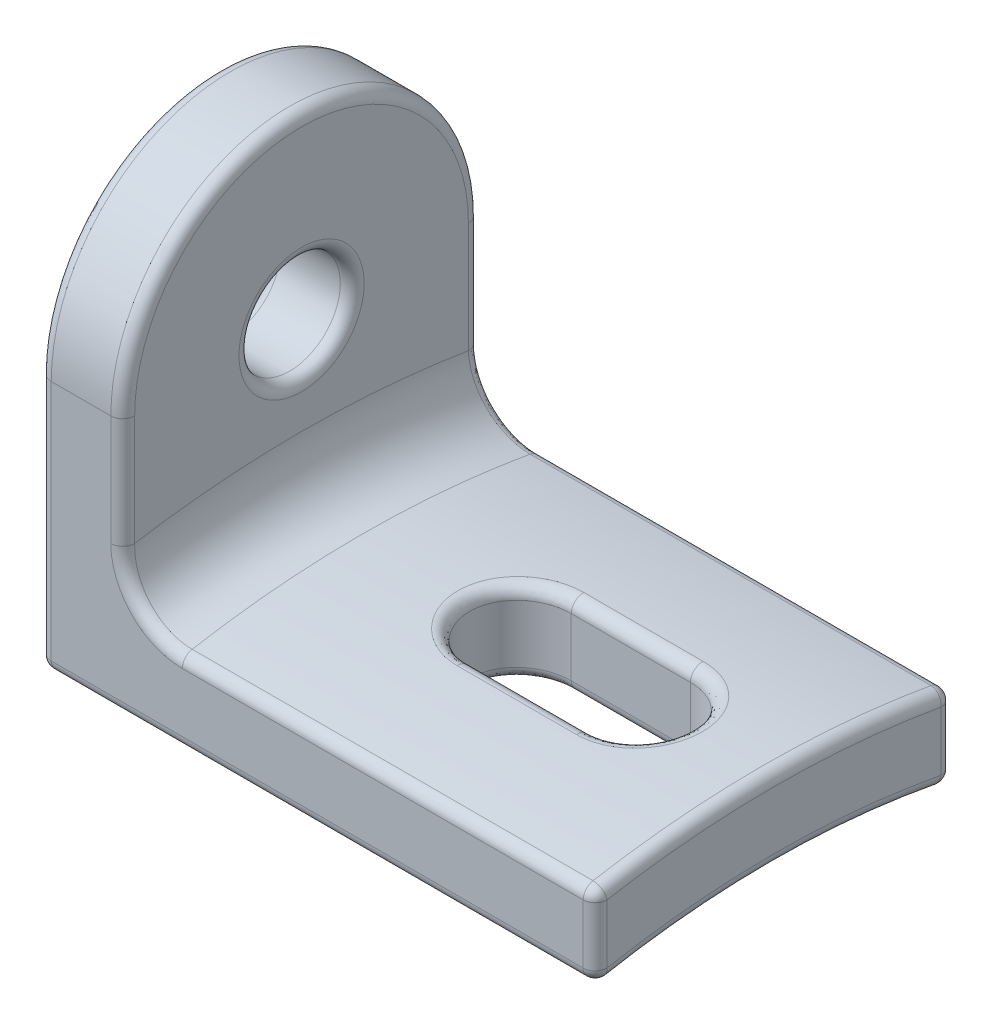
from build123d import *

# Parameters (mm, degrees)
SKETCH1_R           = 6
SKETCH1_R_2         = 1.7
BOSS_EXTRUDE1_DEPTH = 2.8
BOSS_EXTRUDE2_DEPTH = 18.65
CUT_EXTRUDE1_DEPTH  = 15.5
FILLET1_R           = 2
FILLET2_R           = 0.4


with BuildPart() as part:
    # Sketch1 → Boss-Extrude1 (new body)
    # profile 1 of 2: a face of its own
    with BuildSketch(Plane(origin=(0, 0, 0), x_dir=(0, 0, -1), z_dir=(1, 0, 0))):
        Circle(SKETCH1_R)
        Circle(SKETCH1_R_2, mode=Mode.SUBTRACT)
    # profile 2 of 2: a face of its own
    with BuildSketch(Plane(origin=(0, 0, 0), x_dir=(0, 0, -1), z_dir=(1, 0, 0))):
        with BuildLine():
            ThreePointArc((6, 0), (0, -6), (-6, 0))
            Line((-6, 0), (-6, -8.606123087))
            ThreePointArc((-6, -8.606123087), (0, -8), (6, -8.606123087))
            Line((6, -8.606123087), (6, 0))
        make_face()
    extrude(amount=BOSS_EXTRUDE1_DEPTH)

    # Sketch2 → Boss-Extrude2 (add)
    with BuildSketch(Plane.ZY):
        with BuildLine():
            Line((-6, -8.606123087), (-6, -5.806123087))
            ThreePointArc((-6, -5.806123087), (0, -5.251783091), (6, -5.806123087))
            Line((6, -5.806123087), (6, -8.606123087))
            ThreePointArc((6, -8.606123087), (0, -8), (-6, -8.606123087))
        make_face()
    extrude(amount=-BOSS_EXTRUDE2_DEPTH)

    # Sketch3 → Cut-Extrude1 (cut)
    with BuildSketch(Plane(origin=(0, 0, 0), x_dir=(1, 0, 0), z_dir=(0, 1, 0))):
        with BuildLine():
            Line((14.15, -1.7), (10.15, -1.7))
            ThreePointArc((10.15, -1.7), (8.45, 0), (10.15, 1.7))
            Line((10.15, 1.7), (14.15, 1.7))
            ThreePointArc((14.15, 1.7), (15.85, 0), (14.15, -1.7))
        make_face()
    extrude(amount=-CUT_EXTRUDE1_DEPTH, mode=Mode.SUBTRACT)

    # Fillet1
    fillet1_edges = [part.edges().sort_by_distance(p)[0] for p in [
        (2.8, -5.251783091, 0),
    ]]
    fillet(fillet1_edges, radius=FILLET1_R)

    # Fillet2
    fillet2_edges = [part.edges().sort_by_distance(p)[0] for p in [
        (9.325, -8.606123087, -6),
        (9.325, -8.606123087, 6),
        (2.8, -1.886857548, 6),
        (2.8, -1.886857548, -6),
        (18.65, -8, 0),
        (18.65, -7.206123087, -6),
        (11.725, -5.806123087, -6),
        (18.65, -5.251783091, 0),
        (11.725, -5.806123087, 6),
        (18.65, -7.206123087, 6),
        (8.449999989, -5.251783072, 6e-09),
        (12.15, -5.295937397, 1.7),
        (15.85, -5.25178309, -6e-09),
        (12.15, -5.295937397, -1.7),
        (12.15, -8.048205396, -1.7),
        (15.85, -7.999999998, -6e-09),
        (8.449999989, -7.99999998, 6e-09),
        (12.15, -8.048205396, 1.7),
        (2.8, 0, 1.7),
        (3.380328435, -5.204861741, 6),
        (3.380328435, -5.204861741, -6),
        (0, -4.303061543, -6),
        (0, -8, 0),
        (0, -4.303061543, 6),
        (0, 6, 0),
        (0, 0, 1.7),
        (2.8, 6, 0),
    ]]
    fillet(fillet2_edges, radius=FILLET2_R)


solid = part.part
